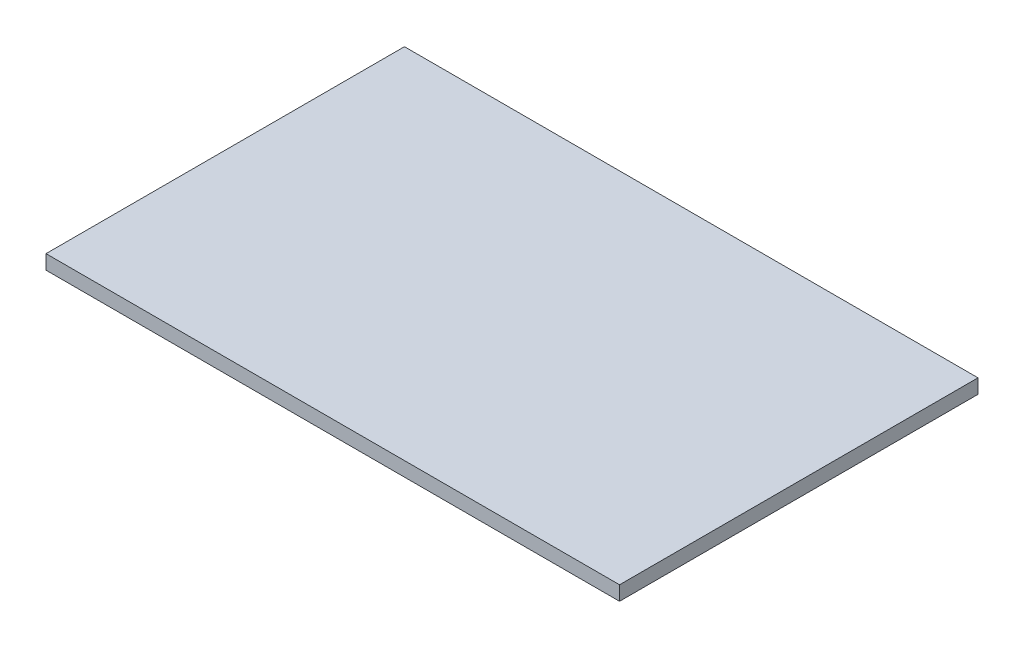
from build123d import *

# Parameters (mm, degrees)
SKETCH1_W           = 400
SKETCH1_H           = 250
BOSS_EXTRUDE1_DEPTH = 10


with BuildPart() as part:
    # Sketch1 → Boss-Extrude1 (new body)
    with BuildSketch(Plane(origin=(0, 0, 0), x_dir=(1, 0, 0), z_dir=(0, 1, 0))):
        Rectangle(SKETCH1_W, SKETCH1_H)
    extrude(amount=BOSS_EXTRUDE1_DEPTH)


solid = part.part
